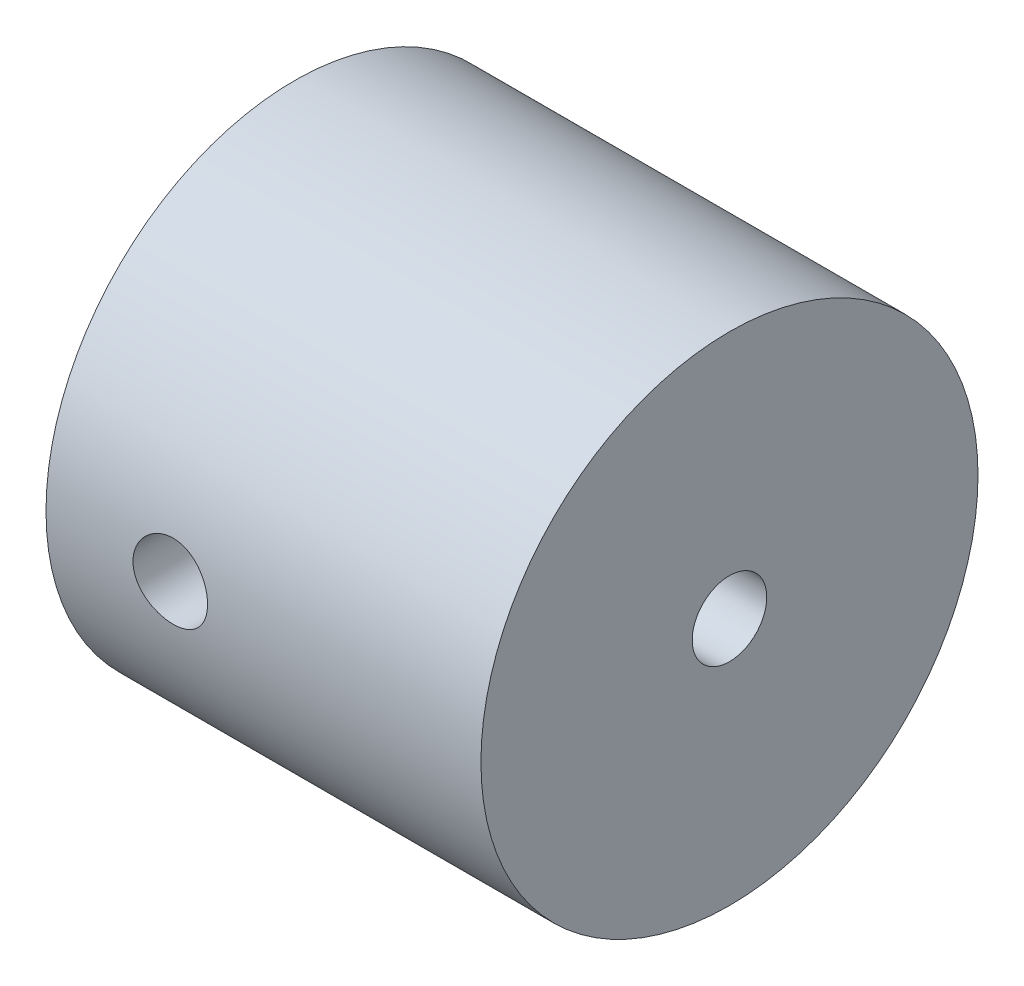
from build123d import *

# Parameters (mm, degrees)
SKETCH_1_R          = 20
EXTRUDE_2_DEPTH     = 10
EXTRUDE_START       = 25
SKETCH_2_R          = 20
SKETCH_2_R_2        = 7
EXTRUDE_3_DEPTH     = 25
SKETCH_3_R          = 3
CUT_EXTRUDE_2_DEPTH = 10
SKETCH_4_R          = 3
CUT_EXTRUDE_3_DEPTH = 20


with BuildPart() as part:
    # 草图1 → 凸台-拉伸2 (new body)
    with BuildSketch(Plane(origin=(0, 0, 0), x_dir=(0, 0, -1), z_dir=(1, 0, 0))):
        Circle(SKETCH_1_R)
    extrude(amount=EXTRUDE_2_DEPTH)

    # 草图2 → 凸台-拉伸3 (add)
    with BuildSketch(Plane.ZY.offset(EXTRUDE_START)):
        Circle(SKETCH_2_R)
        Circle(SKETCH_2_R_2, mode=Mode.SUBTRACT)
    extrude(amount=-EXTRUDE_3_DEPTH)

    # 草图3 → 切除-拉伸2 (cut)
    with BuildSketch(Plane(origin=(10, 0, 0), x_dir=(0, 0, -1), z_dir=(1, 0, 0))):
        Circle(SKETCH_3_R)
    extrude(amount=-CUT_EXTRUDE_2_DEPTH, mode=Mode.SUBTRACT)

    # 草图4 → 切除-拉伸3 (cut, symmetric)
    with BuildSketch(Plane.XY):
        with Locations((-15, 0)):
            Circle(SKETCH_4_R)
    extrude(amount=CUT_EXTRUDE_3_DEPTH, both=True, mode=Mode.SUBTRACT)


solid = part.part
